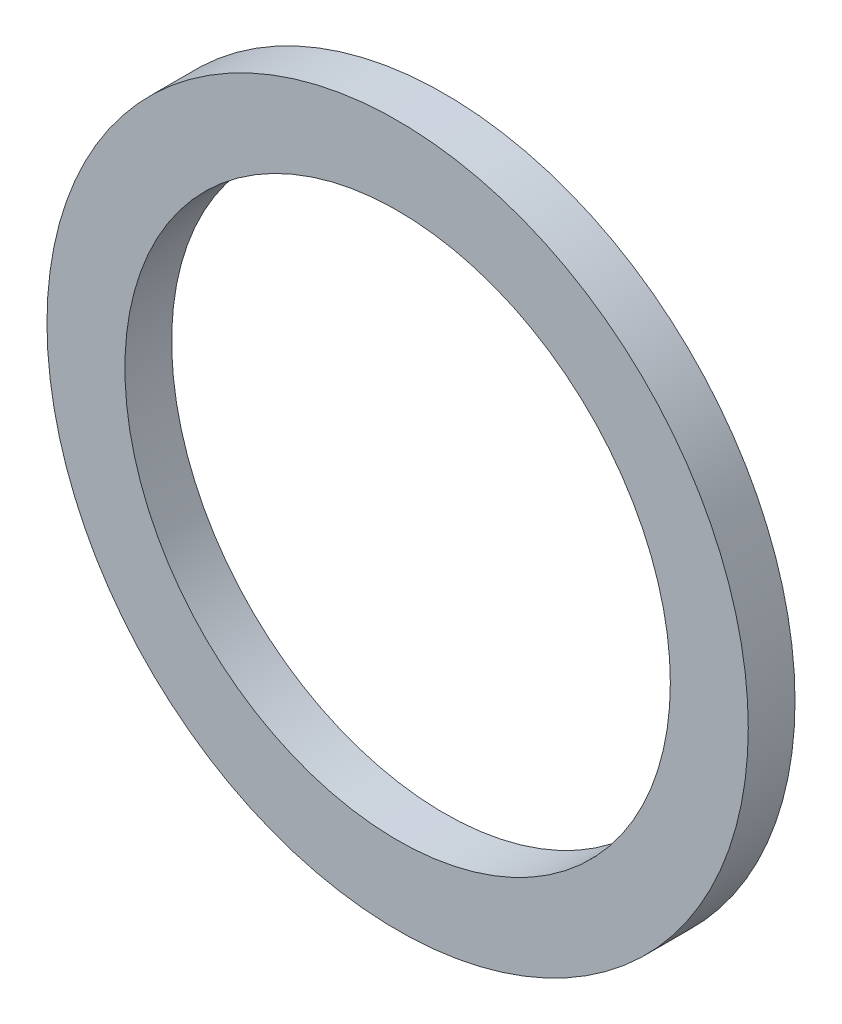
from build123d import *

# Parameters (mm, degrees)
SKETCH1_R           = 22.5
SKETCH1_R_2         = 17.5
BOSS_EXTRUDE1_DEPTH = 2
BOSS_EXTRUDE2_START = 1
SKETCH2_R           = 22.5
BOSS_EXTRUDE2_DEPTH = 1
CUT_EXTRUDE1_START  = -1
SKETCH3_R           = 17.5
CUT_EXTRUDE1_DEPTH  = 1


with BuildPart() as part:
    # Sketch1 → Boss-Extrude1 (new body)
    with BuildSketch(Plane.XY):
        Circle(SKETCH1_R)
        Circle(SKETCH1_R_2, mode=Mode.SUBTRACT)
    extrude(amount=BOSS_EXTRUDE1_DEPTH)

    # Sketch2 → Boss-Extrude2 (add)
    with BuildSketch(Plane(origin=(0, 0, 0), x_dir=(-1, 0, 0), z_dir=(0, 0, -1)).offset(BOSS_EXTRUDE2_START)):
        Circle(SKETCH2_R)
    extrude(amount=-BOSS_EXTRUDE2_DEPTH)

    # Sketch3 → Cut-Extrude1 (cut)
    with BuildSketch(Plane.XY.offset(CUT_EXTRUDE1_START)):
        Circle(SKETCH3_R)
    extrude(amount=CUT_EXTRUDE1_DEPTH, mode=Mode.SUBTRACT)


solid = part.part
